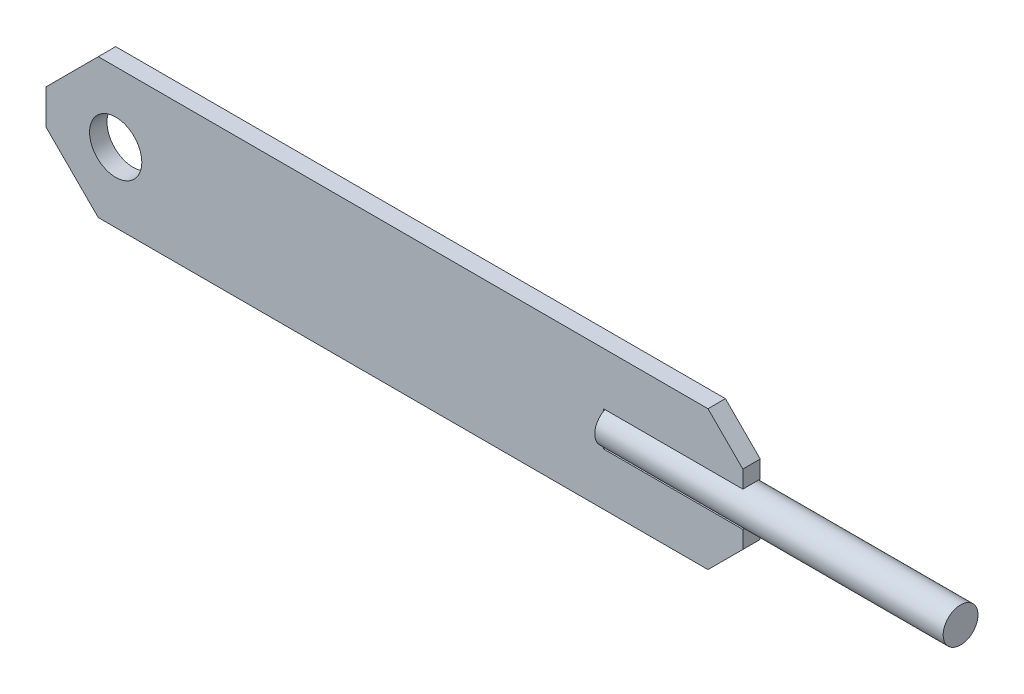
from build123d import *

# Parameters (mm, degrees)
SKETCH1_R           = 15
BOSS_EXTRUDE1_DEPTH = 5
BOSS_EXTRUDE3_START = 120
SKETCH3_R           = 10
BOSS_EXTRUDE3_DEPTH = 200
CHAMFER1_SIZE       = 30


with BuildPart() as part:
    # Sketch1 → Boss-Extrude1 (new, symmetric)
    with BuildSketch(Plane.XY):
        Polygon((-200, 40), (-200, -40), (180, -40), (200, -20), (200, -10), (120, -10), (120, 10), (200, 10), (200, 20), (180, 40), align=None)
        with Locations((-160, 0)):
            Circle(SKETCH1_R, mode=Mode.SUBTRACT)
    extrude(amount=BOSS_EXTRUDE1_DEPTH, both=True)

    # Chamfer1
    chamfer1_edges = [part.edges().sort_by_distance(p)[0] for p in [
        (-200, -40, 0),
        (-200, 40, 0),
    ]]
    chamfer(chamfer1_edges, length=CHAMFER1_SIZE)


with BuildPart() as body_2:
    # Sketch3 → Boss-Extrude3 (new body)
    with BuildSketch(Plane(origin=(0, 0, 0), x_dir=(0, 0, -1), z_dir=(1, 0, 0)).offset(BOSS_EXTRUDE3_START)):
        Circle(SKETCH3_R)
    extrude(amount=BOSS_EXTRUDE3_DEPTH)


solid = Compound([part.part, body_2.part])
